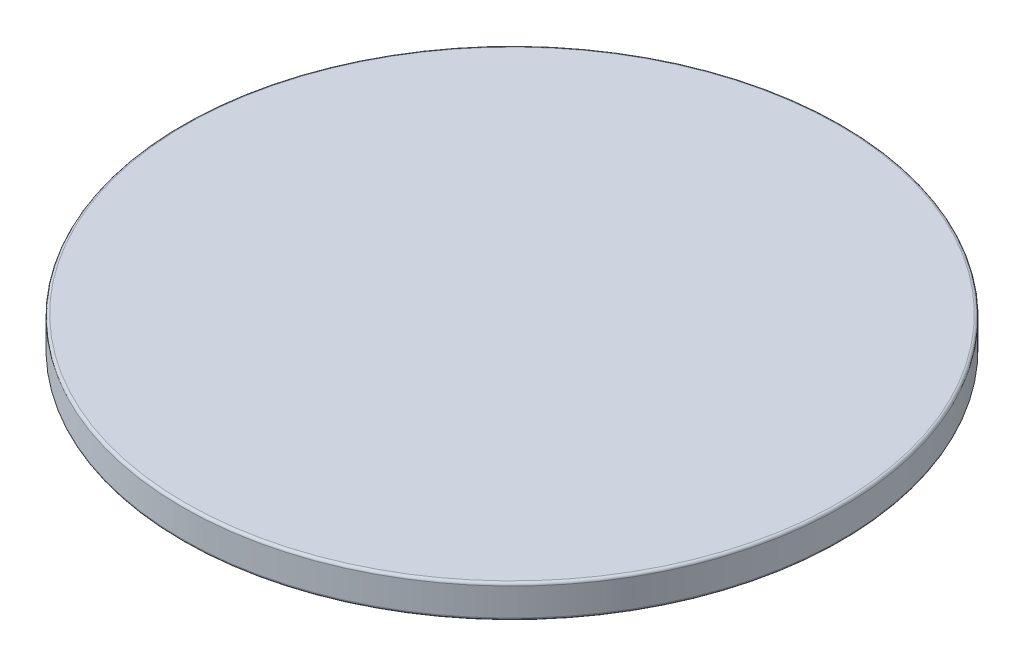
from build123d import *

# Parameters (mm, degrees)
SKETCH1_R           = 250000
BOSS_EXTRUDE1_DEPTH = 25000
FILLET1_R           = 2000


with BuildPart() as part:
    # Sketch1 → Boss-Extrude1 (new body)
    with BuildSketch(Plane(origin=(0, 0, 0), x_dir=(1, 0, 0), z_dir=(0, 1, 0))):
        with Locations(Location((0, 0, 0), (0, 0, 270))):
            Circle(SKETCH1_R)
    extrude(amount=-BOSS_EXTRUDE1_DEPTH)

    # Fillet1
    fillet1_edges = [part.edges().sort_by_distance(p)[0] for p in [
        (0, 0, -250000),
        (0, -25000, -250000),
    ]]
    fillet(fillet1_edges, radius=FILLET1_R)


solid = part.part
